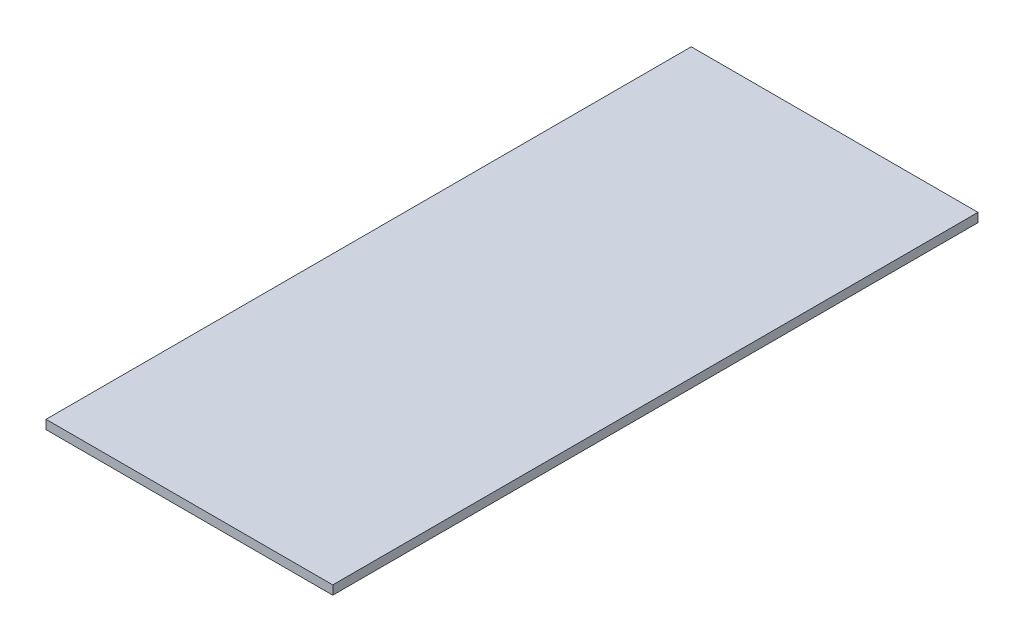
from build123d import *

# Parameters (mm, degrees)
SKETCH1_W           = 101.6
SKETCH1_H           = 228.6
BOSS_EXTRUDE1_DEPTH = 3.175


with BuildPart() as part:
    # Sketch1 → Boss-Extrude1 (new body)
    with BuildSketch(Plane(origin=(0, 0, 0), x_dir=(1, 0, 0), z_dir=(0, 1, 0))):
        with Locations((20.100372359, -71.349692378)):
            Rectangle(SKETCH1_W, SKETCH1_H)
    extrude(amount=BOSS_EXTRUDE1_DEPTH)


solid = part.part
